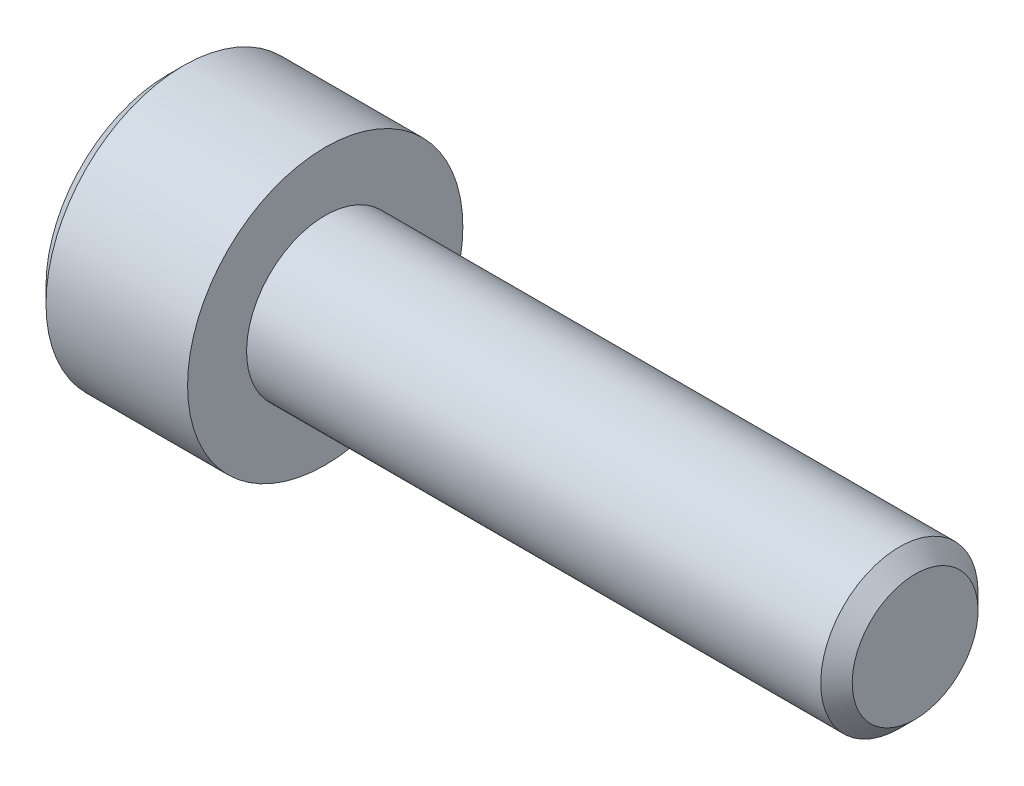
from build123d import *

# Parameters (mm, degrees)
CHAMFER1_SIZE      = 0.4
CUT_EXTRUDE1_DEPTH = 2


with BuildPart() as part:
    # Sketch1 → Revolve1 (revolve)
    with BuildSketch(Plane.XY, mode=Mode.PRIVATE) as revolve1_sk:
        Polygon((-4, 0), (-4, 3.1), (-3.6, 3.5), (0, 3.5), (0, 2), (15, 2), (15, 0), align=None)
    revolve(revolve1_sk.sketch.rotate(Axis((15, 0, 0), (-1, 0, 0)), 180), axis=Axis((15, 0, 0), (-1, 0, 0)))

    # Chamfer1
    chamfer1_edges = [part.edges().sort_by_distance(p)[0] for p in [
        (15, 2, 0),
    ]]
    chamfer(chamfer1_edges, length=CHAMFER1_SIZE)

    # Sketch2 → Cut-Revolve1 (revolve, cut)
    with BuildSketch(Plane.XY, mode=Mode.PRIVATE) as cut_revolve1_sk:
        Polygon((-4, 0), (-4, 1.5), (-2, 1.5), (-1.598076211, 0), align=None)
    revolve(cut_revolve1_sk.sketch.rotate(Axis((-1.598076211, 0, 0), (-1, 0, 0)), 270), axis=Axis((-1.598076211, 0, 0), (-1, 0, 0)), mode=Mode.SUBTRACT)

    # Sketch3 → Cut-Extrude1 (cut)
    with BuildSketch(Plane(origin=(-4, 0, 0), x_dir=(0, 0, -1), z_dir=(1, 0, 0))):
        Polygon((-1.5, 0.866025404), (-1.5, -0.866025404), (0, -1.732050808), (1.5, -0.866025404), (1.5, 0.866025404), (0, 1.732050808), align=None)
    extrude(amount=CUT_EXTRUDE1_DEPTH, mode=Mode.SUBTRACT)


solid = part.part
